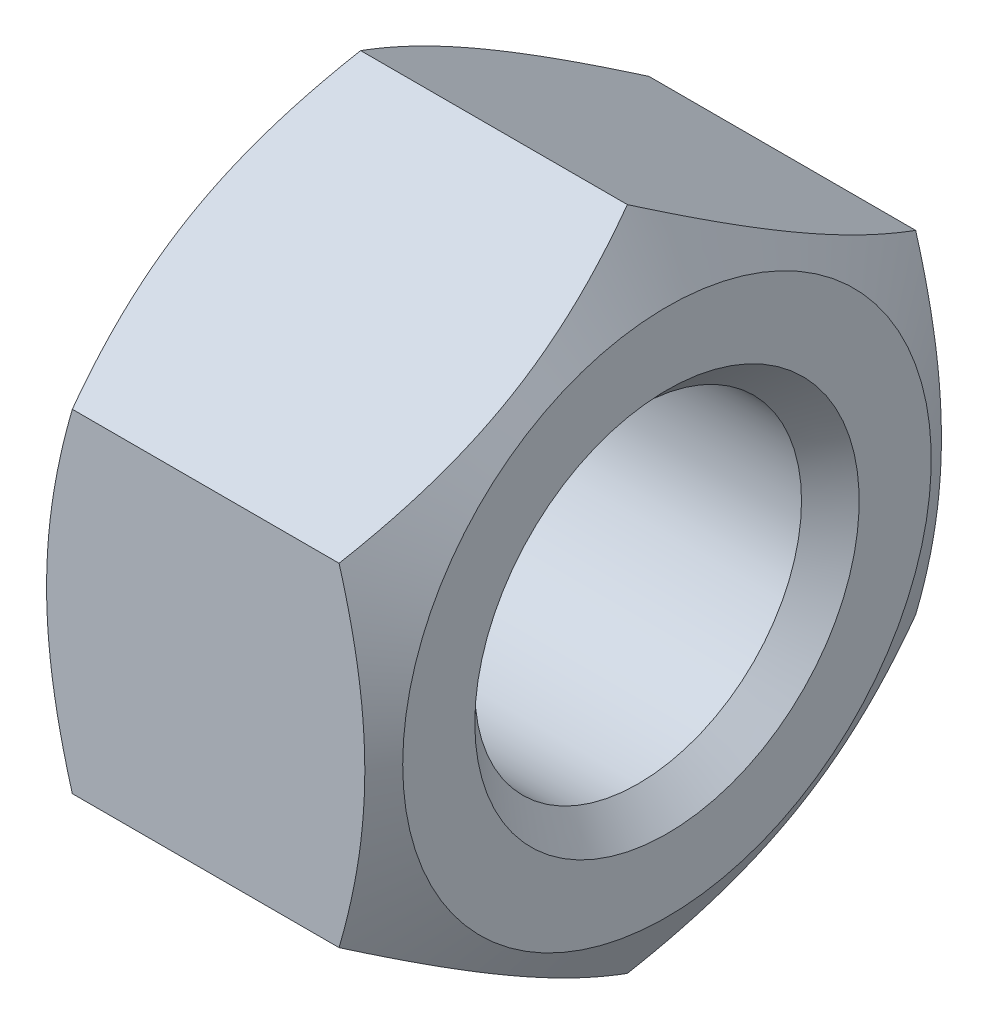
from build123d import *

# Parameters (mm, degrees)
SKETCH_2_OUTSIDE_W  = 30.08
SKETCH_2_OUTSIDE_H  = 30.08
CUT_EXTRUDE_1_DEPTH = 19.706148722


with BuildPart() as part:
    # Эскиз1 → Повернуть1 (revolve)
    with BuildSketch(Plane.XY, mode=Mode.PRIVATE) as revolve_1_sk:
        Polygon((0.9, 5.1), (9.9, 5.1), (10.8, 6), (10.8, 8.25), (9.327756814, 10.8), (1.472243186, 10.8), (0, 8.25), (0, 6), align=None)
    revolve(revolve_1_sk.sketch.rotate(Axis((0, 0, 0), (1, 0, 0)), 90), axis=Axis((0, 0, 0), (1, 0, 0)))

    # Эскиз2 outside → Вырез-Вытянуть1 (cut, through all)
    with BuildSketch(Plane.ZY):
        Rectangle(SKETCH_2_OUTSIDE_W, SKETCH_2_OUTSIDE_H)
        Polygon((0, 10.392304845), (-9, 5.196152423), (-9, -5.196152423), (0, -10.392304845), (9, -5.196152423), (9, 5.196152423), align=None, mode=Mode.SUBTRACT)
    extrude(amount=-CUT_EXTRUDE_1_DEPTH, mode=Mode.SUBTRACT)


solid = part.part
